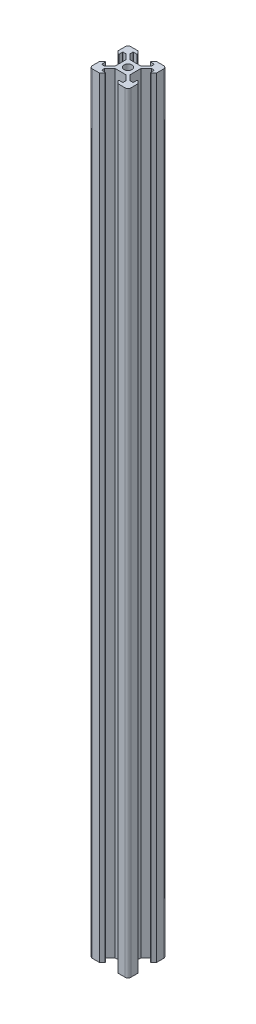
from build123d import *

# Parameters (mm, degrees)
SALIENTE_EXTRUIR1_DEPTH = 400
REDONDEO1_R             = 1.5
REDONDEO2_R             = 0.2


with BuildPart() as part:
    # Croquis1 → Saliente-Extruir1 (new body)
    with BuildSketch(Plane(origin=(0, 0, 0), x_dir=(1, 0, 0), z_dir=(0, 1, 0))):
        with BuildLine():
            Line((-4.9, 10), (-10, 10))
            Line((-10, 10), (-10, 4.9))
            Line((-10, 4.9), (-8.2, 3.1))
            Line((-8.2, 3.1), (-8.2, 5.539339828))
            Line((-8.2, 5.539339828), (-6.6, 5.539339828))
            Line((-6.6, 5.539339828), (-3.900660172, 2.84))
            Line((-3.900660172, 2.84), (-1.917323237, 0.856663065))
            ThreePointArc((-1.917323237, 0.856663065), (-1.48492424, 1.48492424), (-0.856663065, 1.917323237))
            Line((-0.856663065, 1.917323237), (-2.84, 3.900660172))
            Line((-2.84, 3.900660172), (-5.539339828, 6.6))
            Line((-5.539339828, 6.6), (-5.539339828, 8.2))
            Line((-5.539339828, 8.2), (-3.1, 8.2))
            Line((-3.1, 8.2), (-4.9, 10))
        make_face()
        with BuildLine():
            Line((-8.2, -3.1), (-10, -4.9))
            Line((-10, -4.9), (-10, -10))
            Line((-10, -10), (-4.9, -10))
            Line((-4.9, -10), (-3.1, -8.2))
            Line((-3.1, -8.2), (-5.539339828, -8.2))
            Line((-5.539339828, -8.2), (-5.539339828, -6.6))
            Line((-5.539339828, -6.6), (-2.84, -3.900660172))
            Line((-2.84, -3.900660172), (-0.856663065, -1.917323237))
            ThreePointArc((-0.856663065, -1.917323237), (-1.48492424, -1.48492424), (-1.917323237, -0.856663065))
            Line((-1.917323237, -0.856663065), (-3.900660172, -2.84))
            Line((-3.900660172, -2.84), (-6.6, -5.539339828))
            Line((-6.6, -5.539339828), (-8.2, -5.539339828))
            Line((-8.2, -5.539339828), (-8.2, -3.1))
        make_face()
        with BuildLine():
            Line((10, -10), (10, -4.9))
            Line((10, -4.9), (8.2, -3.1))
            Line((8.2, -3.1), (8.2, -5.539339828))
            Line((8.2, -5.539339828), (6.6, -5.539339828))
            Line((6.6, -5.539339828), (3.900660172, -2.84))
            Line((3.900660172, -2.84), (1.917323237, -0.856663065))
            ThreePointArc((1.917323237, -0.856663065), (1.48492424, -1.48492424), (0.856663065, -1.917323237))
            Line((0.856663065, -1.917323237), (2.84, -3.900660172))
            Line((2.84, -3.900660172), (5.539339828, -6.6))
            Line((5.539339828, -6.6), (5.539339828, -8.2))
            Line((5.539339828, -8.2), (3.1, -8.2))
            Line((3.1, -8.2), (4.9, -10))
            Line((4.9, -10), (10, -10))
        make_face()
        with BuildLine():
            Line((10, 10), (4.9, 10))
            Line((4.9, 10), (3.1, 8.2))
            Line((3.1, 8.2), (5.539339828, 8.2))
            Line((5.539339828, 8.2), (5.539339828, 6.6))
            Line((5.539339828, 6.6), (2.84, 3.900660172))
            Line((2.84, 3.900660172), (0.856663065, 1.917323237))
            ThreePointArc((0.856663065, 1.917323237), (1.48492424, 1.48492424), (1.917323237, 0.856663065))
            Line((1.917323237, 0.856663065), (3.900660172, 2.84))
            Line((3.900660172, 2.84), (6.6, 5.539339828))
            Line((6.6, 5.539339828), (8.2, 5.539339828))
            Line((8.2, 5.539339828), (8.2, 3.1))
            Line((8.2, 3.1), (10, 4.9))
            Line((10, 4.9), (10, 10))
        make_face()
        with BuildLine():
            Line((-1.917323237, 0.856663065), (-3.900660172, 2.84))
            Line((-3.900660172, 2.84), (-3.900660172, -2.84))
            Line((-3.900660172, -2.84), (-1.917323237, -0.856663065))
            ThreePointArc((-1.917323237, -0.856663065), (-2.1, 0), (-1.917323237, 0.856663065))
        make_face()
        with BuildLine():
            Line((-0.856663065, -1.917323237), (-2.84, -3.900660172))
            Line((-2.84, -3.900660172), (2.84, -3.900660172))
            Line((2.84, -3.900660172), (0.856663065, -1.917323237))
            ThreePointArc((0.856663065, -1.917323237), (0, -2.1), (-0.856663065, -1.917323237))
        make_face()
        with BuildLine():
            Line((3.900660172, -2.84), (3.900660172, 2.84))
            Line((3.900660172, 2.84), (1.917323237, 0.856663065))
            ThreePointArc((1.917323237, 0.856663065), (2.053823118, 0.437961872), (2.1, 0))
            ThreePointArc((2.1, 0), (2.053823118, -0.437961872), (1.917323237, -0.856663065))
            Line((1.917323237, -0.856663065), (3.900660172, -2.84))
        make_face()
        with BuildLine():
            Line((2.84, 3.900660172), (-2.84, 3.900660172))
            Line((-2.84, 3.900660172), (-0.856663065, 1.917323237))
            ThreePointArc((-0.856663065, 1.917323237), (0, 2.1), (0.856663065, 1.917323237))
            Line((0.856663065, 1.917323237), (2.84, 3.900660172))
        make_face()
    extrude(amount=SALIENTE_EXTRUIR1_DEPTH)

    # Redondeo1
    redondeo1_edges = [part.edges().sort_by_distance(p)[0] for p in [
        (-10, 200, 10),
        (-10, 200, -10),
        (10, 200, -10),
        (10, 200, 10),
    ]]
    fillet(redondeo1_edges, radius=REDONDEO1_R)

    # Redondeo2
    redondeo2_edges = [part.edges().sort_by_distance(p)[0] for p in [
        (-5.539339828, 200, 8.2),
        (-3.1, 200, 8.2),
        (-8.2, 200, 3.1),
        (-8.2, 200, 5.539339828),
        (-8.2, 200, -5.539339828),
        (-8.2, 200, -3.1),
        (-3.1, 200, -8.2),
        (-5.539339828, 200, -8.2),
        (5.539339828, 200, -8.2),
        (3.1, 200, -8.2),
        (8.2, 200, -3.1),
        (8.2, 200, -5.539339828),
        (8.2, 200, 5.539339828),
        (8.2, 200, 3.1),
        (3.1, 200, 8.2),
        (5.539339828, 200, 8.2),
    ]]
    fillet(redondeo2_edges, radius=REDONDEO2_R)


solid = part.part
